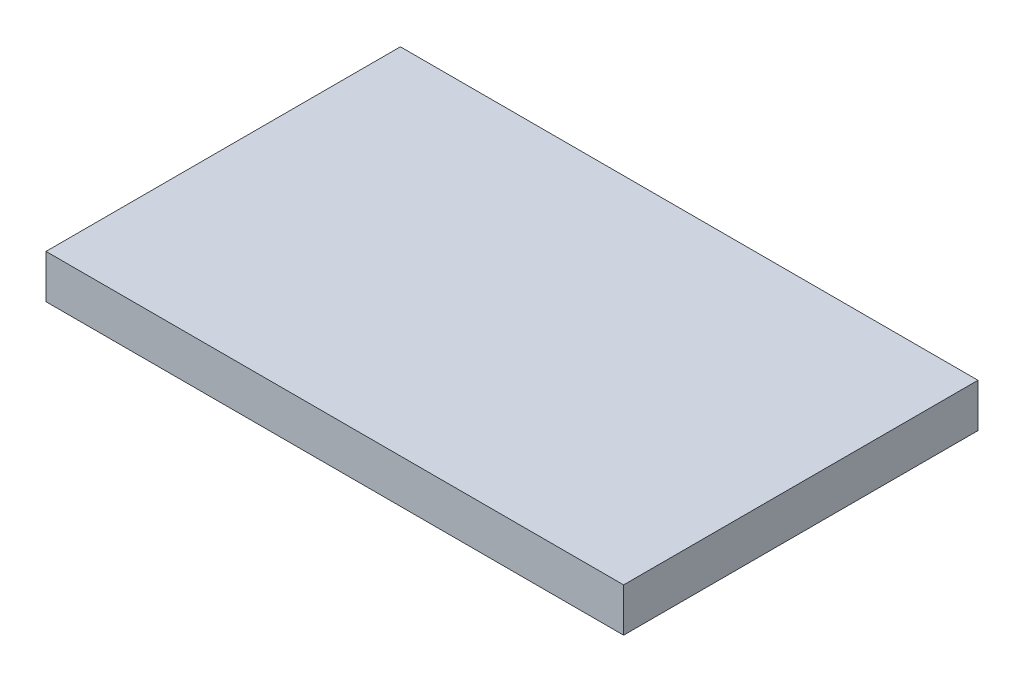
from build123d import *

# Parameters (mm, degrees)
SKETCH1_W           = 41.4
SKETCH1_H           = 25.4
BOSS_EXTRUDE1_DEPTH = 3.125


with BuildPart() as part:
    # Sketch1 → Boss-Extrude1 (new body)
    with BuildSketch(Plane(origin=(0, 0, 0), x_dir=(1, 0, 0), z_dir=(0, 1, 0))):
        with Locations((20.7, 12.7)):
            Rectangle(SKETCH1_W, SKETCH1_H)
    extrude(amount=BOSS_EXTRUDE1_DEPTH)


solid = part.part
